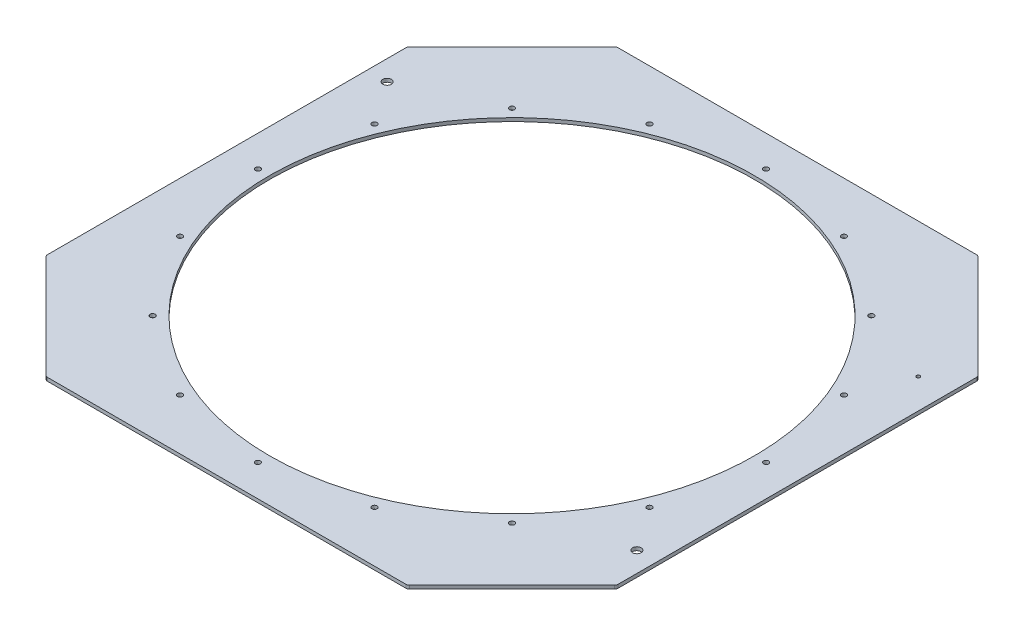
from build123d import *

# Parameters (mm, degrees)
BOSS_EXTRUDE1_DEPTH = 6
SKETCH2_R           = 422.5
CUT_EXTRUDE1_DEPTH  = 6
SKETCH3_R           = 4.5
CUT_EXTRUDE2_DEPTH  = 6
CIRPATTERN1_COUNT   = 16
SKETCH4_R           = 3
CUT_EXTRUDE3_DEPTH  = 10
SKETCH5_R           = 7.5
CUT_EXTRUDE4_DEPTH  = 10
FILLET1_R           = 6


with BuildPart() as part:
    # Sketch1 → Boss-Extrude1 (new body)
    with BuildSketch(Plane(origin=(0, 0, 0), x_dir=(1, 0, 0), z_dir=(0, 1, 0))):
        Polygon((315.066450454, 496.5), (497.5, 314.066450454), (497.5, -315.066450454), (315.066450454, -497.5), (-314.066450454, -497.5), (-496.5, -315.066450454), (-496.5, 314.066450454), (-314.066450454, 496.5), align=None)
    extrude(amount=BOSS_EXTRUDE1_DEPTH)

    # Sketch2 → Cut-Extrude1 (cut)
    with BuildSketch(Plane(origin=(0, 6, 0), x_dir=(1, 0, 0), z_dir=(0, 1, 0))):
        with Locations(Location((0, 0, 0), (0, 0, 270))):
            Circle(SKETCH2_R)
    extrude(amount=-CUT_EXTRUDE1_DEPTH, mode=Mode.SUBTRACT)

    # Sketch3 → Cut-Extrude2 (cut)
    with BuildSketch(Plane(origin=(0, 6, 0), x_dir=(1, 0, 0), z_dir=(0, 1, 0))):
        with Locations(Location((0, 442.5, 0), (0, 0, 270))):
            Circle(SKETCH3_R)
    cut_extrude2 = extrude(amount=-CUT_EXTRUDE2_DEPTH, mode=Mode.SUBTRACT)

    # CirPattern1: Cut-Extrude2 ×16 about axis
    cirpattern1_axis = Axis((0, 0, 0), (0, 1, 0))
    for i in range(1, CIRPATTERN1_COUNT):
        add(cut_extrude2.rotate(cirpattern1_axis, i * 360 / CIRPATTERN1_COUNT), mode=Mode.SUBTRACT)

    # Sketch4 → Cut-Extrude3 (cut)
    with BuildSketch(Plane(origin=(0, 6, 0), x_dir=(1, 0, 0), z_dir=(0, 1, 0))):
        with Locations(Location((445.5, 262.066450454, 0), (0, 0, 270))):
            Circle(SKETCH4_R)
    extrude(amount=-CUT_EXTRUDE3_DEPTH, mode=Mode.SUBTRACT)

    # Sketch5 → Cut-Extrude4 (cut)
    with BuildSketch(Plane(origin=(0, 6, 0), x_dir=(1, 0, 0), z_dir=(0, 1, 0))):
        with Locations(Location((-461.5, 244.066450454, 0), (0, 0, 270))):
            Circle(SKETCH5_R)
        with Locations(Location((462.5, -245.066450454, 0), (0, 0, 270))):
            Circle(SKETCH5_R)
    extrude(amount=-CUT_EXTRUDE4_DEPTH, mode=Mode.SUBTRACT)

    # Fillet1
    fillet1_edges = [part.edges().sort_by_distance(p)[0] for p in [
        (315.066450454, 3, -496.5),
        (497.5, 3, -314.066450454),
        (497.5, 3, 315.066450454),
        (315.066450454, 3, 497.5),
        (-314.066450454, 3, 497.5),
        (-496.5, 3, 315.066450454),
        (-496.5, 3, -314.066450454),
        (-314.066450454, 3, -496.5),
    ]]
    fillet(fillet1_edges, radius=FILLET1_R)


solid = part.part
